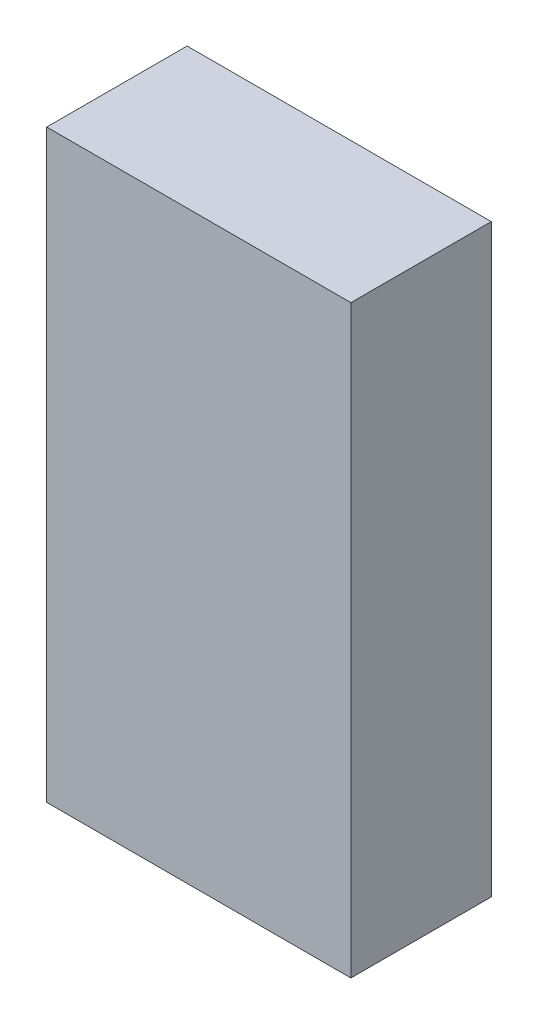
from build123d import *

# Parameters (mm, degrees)
SKIZZE1_W                       = 26
SKIZZE1_H                       = 50
AUFSATZ_LINEAR_AUSTRAGEN1_DEPTH = 12


with BuildPart() as part:
    # Skizze1 → Aufsatz-Linear austragen1 (new body)
    with BuildSketch(Plane.XY):
        with Locations((13, 25)):
            Rectangle(SKIZZE1_W, SKIZZE1_H)
    extrude(amount=AUFSATZ_LINEAR_AUSTRAGEN1_DEPTH)


solid = part.part
